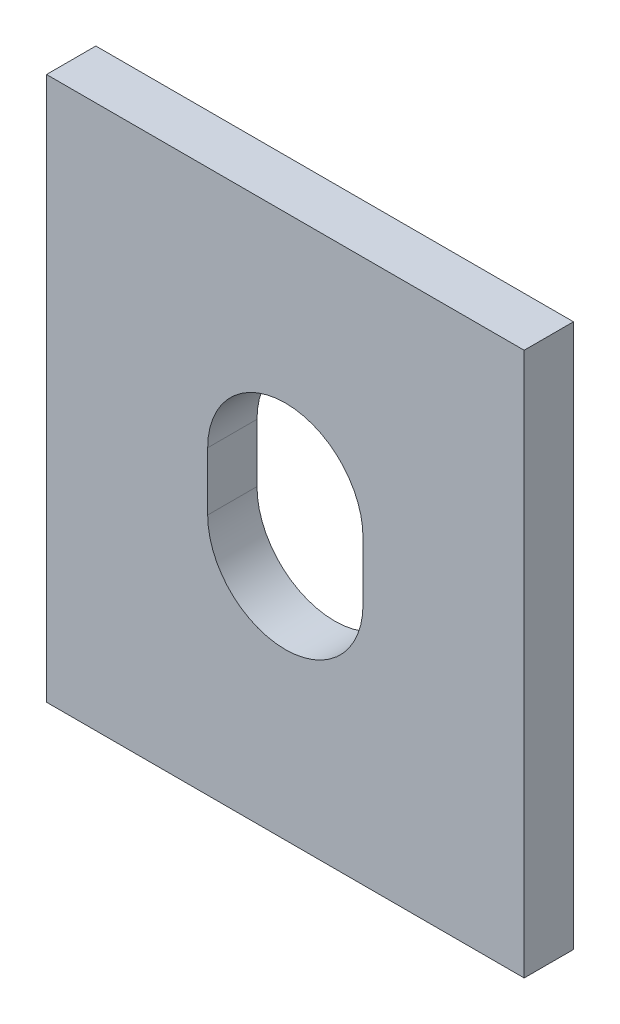
from build123d import *

# Parameters (mm, degrees)
SKETCH1_W           = 246
SKETCH1_H           = 280
BOSS_EXTRUDE1_DEPTH = 25.4
CUT_EXTRUDE1_DEPTH  = 189.080195661


with BuildPart() as part:
    # Sketch1 → Boss-Extrude1 (new body)
    with BuildSketch(Plane.XY):
        Rectangle(SKETCH1_W, SKETCH1_H)
    extrude(amount=BOSS_EXTRUDE1_DEPTH)

    # Sketch2 → Cut-Extrude1 (cut, through all)
    with BuildSketch(Plane.XY.offset(25.4)):
        with BuildLine():
            Line((40, 15), (40, -15))
            ThreePointArc((40, -15), (0, -55), (-40, -15))
            Line((-40, -15), (-40, 15))
            ThreePointArc((-40, 15), (0, 55), (40, 15))
        make_face()
    extrude(amount=-CUT_EXTRUDE1_DEPTH, mode=Mode.SUBTRACT)


solid = part.part
